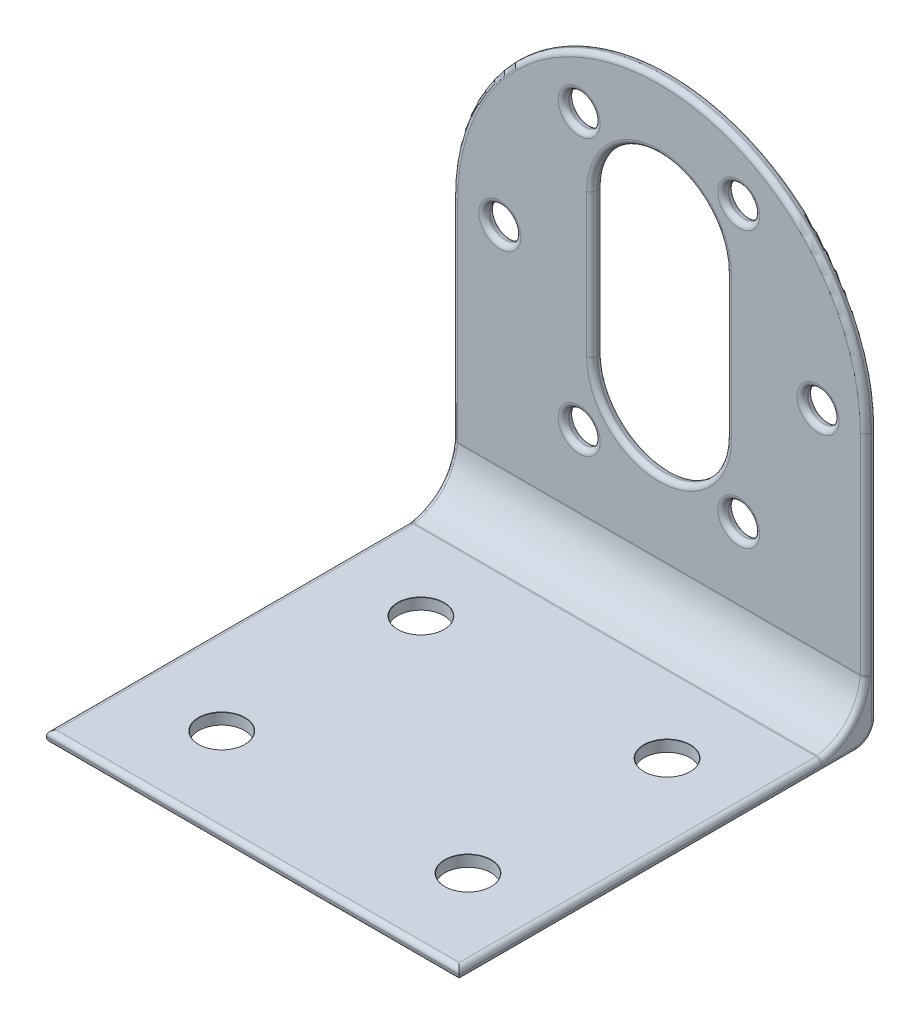
from build123d import *

# Parameters (mm, degrees)
SKETCH1_R                     = 1.55
BOSS_EXTRUDE1_DEPTH           = 1.1
SKETCH2_W                     = 40.35
SKETCH2_H                     = 1.1
BOSS_EXTRUDE2_DEPTH           = 39.7
BOSS_EXTRUDE3_DEPTH           = 40.35
FILLET1_R                     = 2
FILLET2_R                     = 0.5
M4_CLEARANCE_HOLE1_AT_2_COUNT = 2
M4_CLEARANCE_HOLE1_AT_2_PITCH = 24.06
M4_CLEARANCE_HOLE1_AT_3_COUNT = 2
M4_CLEARANCE_HOLE1_AT_3_PITCH = 30.944589175
M4_CLEARANCE_HOLE1_AT_4_COUNT = 2
M4_CLEARANCE_HOLE1_AT_4_PITCH = 19.459804706


with BuildPart() as part:
    # Sketch1 → Boss-Extrude1 (new body)
    with BuildSketch(Plane.XY):
        with BuildLine():
            Line((-26.507558098, -12.316599948), (13.842441902, -12.316599948))
            Line((13.842441902, -12.316599948), (13.842441902, -2.816599948))
            Line((13.842441902, -2.816599948), (13.842441902, 14.008400052))
            ThreePointArc((13.842441902, 14.008400052), (-6.332558098, 34.183400052), (-26.507558098, 14.008400052))
            Line((-26.507558098, 14.008400052), (-26.507558098, -2.816599948))
            Line((-26.507558098, -2.816599948), (-26.507558098, -12.316599948))
        make_face()
        with Locations((-14.132558098, 27.460630351)):
            Circle(SKETCH1_R, mode=Mode.SUBTRACT)
        with Locations((-21.882558098, 14.008400052)):
            Circle(SKETCH1_R, mode=Mode.SUBTRACT)
        with Locations((1.467441902, 27.460630351)):
            Circle(SKETCH1_R, mode=Mode.SUBTRACT)
        with Locations((9.217441902, 14.008400052)):
            Circle(SKETCH1_R, mode=Mode.SUBTRACT)
        with Locations((1.467441902, 0.556169754)):
            Circle(SKETCH1_R, mode=Mode.SUBTRACT)
        with Locations((-14.132558098, 0.556169754)):
            Circle(SKETCH1_R, mode=Mode.SUBTRACT)
        with BuildLine():
            Line((0.242441902, 7.128400052), (0.242441902, 21.108400052))
            ThreePointArc((0.242441902, 21.108400052), (-6.332558098, 27.683400052), (-12.907558098, 21.108400052))
            Line((-12.907558098, 21.108400052), (-12.907558098, 7.128400052))
            ThreePointArc((-12.907558098, 7.128400052), (-6.332558098, 0.553400052), (0.242441902, 7.128400052))
        make_face(mode=Mode.SUBTRACT)
    extrude(amount=BOSS_EXTRUDE1_DEPTH)

    # Sketch2 → Boss-Extrude2 (add)
    with BuildSketch(Plane.XY.offset(1.1)):
        with Locations((-6.332558098, -11.766599948)):
            Rectangle(SKETCH2_W, SKETCH2_H)
    extrude(amount=BOSS_EXTRUDE2_DEPTH)

    # Sketch3 → Boss-Extrude3 (add)
    with BuildSketch(Plane(origin=(13.842441902, 0, 0), x_dir=(0, 0, -1), z_dir=(1, 0, 0))):
        with BuildLine():
            Line((0, -12.316599948), (-5.36794749, -12.316599948))
            Line((-5.36794749, -12.316599948), (-5.36794749, -11.216599948))
            add(Edge.make_bspline(
                [(-1.1, -6.505104198), (-1.599480464, -10.419111845), (-5.36794749, -11.216599948)],
                knots=[0, 0, 0, 1, 1, 1], degree=2))
            Line((-1.1, -6.505104198), (0, -6.505104198))
            Line((0, -6.505104198), (0, -12.316599948))
        make_face()
    extrude(amount=-BOSS_EXTRUDE3_DEPTH)

    # Fillet1
    fillet1_edges = [part.edges().sort_by_distance(p)[0] for p in [
        (-6.332558098, -12.316599948, 0),
    ]]
    fillet(fillet1_edges, radius=FILLET1_R)

    # Fillet2
    fillet2_edges = [part.edges().sort_by_distance(p)[0] for p in [
        (-26.507558098, -11.73081351, 0.585786438),
        (13.842441902, -12.316599948, 21.4),
        (-26.507558098, -12.316599948, 21.4),
        (-15.682558098, 27.460630351, 0),
        (-15.682558098, 27.460630351, 1.1),
        (-6.332558098, 34.183400052, 1.1),
        (-23.432558098, 14.008400052, 0),
        (-23.432558098, 14.008400052, 1.1),
        (-0.082558098, 27.460630351, 0),
        (-0.082558098, 27.460630351, 1.1),
        (7.667441902, 14.008400052, 0),
        (7.667441902, 14.008400052, 1.1),
        (-0.082558098, 0.556169754, 0),
        (-0.082558098, 0.556169754, 1.1),
        (-15.682558098, 0.556169754, 0),
        (-15.682558098, 0.556169754, 1.1),
        (-6.332558098, 27.683400052, 0),
        (-12.907558098, 14.118400052, 0),
        (-6.332558098, 0.553400052, 0),
        (0.242441902, 14.118400052, 0),
        (-6.332558098, 27.683400052, 1.1),
        (-12.907558098, 14.118400052, 1.1),
        (-6.332558098, 0.553400052, 1.1),
        (0.242441902, 14.118400052, 1.1),
        (-26.507558098, 3.751647927, 1.1),
        (-26.507558098, -11.216599948, 23.083973745),
        (13.842441902, -11.216599948, 23.083973745),
        (-6.332558098, -12.316599948, 40.8),
        (-6.332558098, -11.216599948, 40.8),
        (-26.507558098, 1.845900052, 0),
        (-6.332558098, 34.183400052, 0),
        (13.842441902, 3.751647927, 1.1),
        (-6.332558098, -11.216599948, 5.36794749),
        (-6.332558098, -6.505104198, 1.1),
        (13.842441902, -9.620777593, 2.399431344),
        (-26.507558098, -9.620777593, 2.399431344),
        (13.842441902, 1.845900052, 0),
        (13.842441902, -11.73081351, 0.585786438),
    ]]
    fillet(fillet2_edges, radius=FILLET2_R)

    # Sketch5 → M4 Clearance Hole1 (revolve, cut)
    with BuildSketch(Plane(origin=(-17.862558098, -11.216599948, 12.84), x_dir=(0, 0, 1), z_dir=(1, 0, 0))):
        Polygon((0, 0), (0, 1.1), (2.25, 1.1), (2.25, 0.025), (2.275, 0), align=None)
    m4_clearance_hole1 = revolve(axis=Axis((-17.862558098, -4.866599948, 12.84), (0, -1, 0)), mode=Mode.SUBTRACT)

    # M4 Clearance Hole1 at 2: M4 Clearance Hole1 ×2
    with Locations(*[(i * M4_CLEARANCE_HOLE1_AT_2_PITCH, 0, 0) for i in range(1, M4_CLEARANCE_HOLE1_AT_2_COUNT)]):
        add(m4_clearance_hole1, mode=Mode.SUBTRACT)

    # M4 Clearance Hole1 at 3: M4 Clearance Hole1 ×2
    with Locations(*[Vector(0.7775188051098192, 0, 0.6288596884048134) * (i * M4_CLEARANCE_HOLE1_AT_3_PITCH) for i in range(1, M4_CLEARANCE_HOLE1_AT_3_COUNT)]):
        add(m4_clearance_hole1, mode=Mode.SUBTRACT)

    # M4 Clearance Hole1 at 4: M4 Clearance Hole1 ×2
    with Locations(*[(0, 0, i * M4_CLEARANCE_HOLE1_AT_4_PITCH) for i in range(1, M4_CLEARANCE_HOLE1_AT_4_COUNT)]):
        add(m4_clearance_hole1, mode=Mode.SUBTRACT)


solid = part.part
